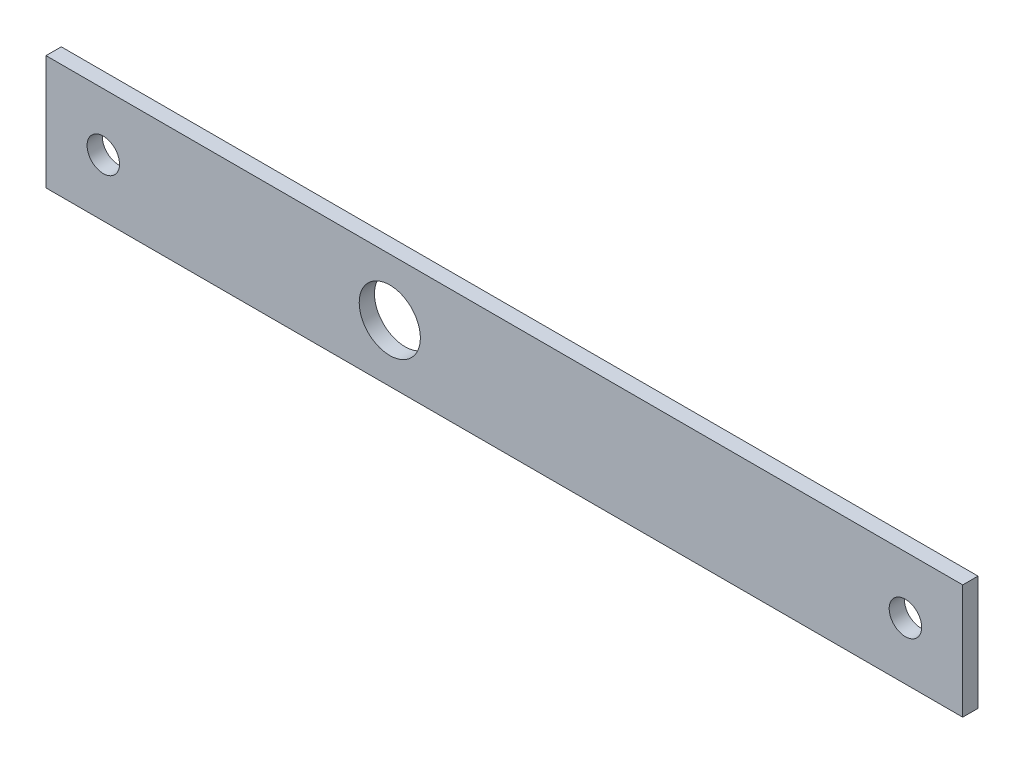
from build123d import *

# Parameters (mm, degrees)
SKETCH1_W           = 240
SKETCH1_H           = 30
BOSS_EXTRUDE1_DEPTH = 4
SKETCH2_R           = 4.25
CUT_EXTRUDE1_DEPTH  = 242.900806117
SKETCH3_R           = 8
CUT_EXTRUDE2_DEPTH  = 242.900806117


with BuildPart() as part:
    # Sketch1 → Boss-Extrude1 (new body)
    with BuildSketch(Plane.XY):
        with Locations((120, 15)):
            Rectangle(SKETCH1_W, SKETCH1_H)
    extrude(amount=BOSS_EXTRUDE1_DEPTH)

    # Sketch2 → Cut-Extrude1 (cut, through all)
    with BuildSketch(Plane.XY.offset(4)):
        with Locations((225, 15)):
            Circle(SKETCH2_R)
        with Locations((15, 15)):
            Circle(SKETCH2_R)
    extrude(amount=-CUT_EXTRUDE1_DEPTH, mode=Mode.SUBTRACT)

    # Sketch3 → Cut-Extrude2 (cut, through all)
    with BuildSketch(Plane(origin=(0, 0, 0), x_dir=(-1, 0, 0), z_dir=(0, 0, -1))):
        with Locations((-90, 15)):
            Circle(SKETCH3_R)
    extrude(amount=-CUT_EXTRUDE2_DEPTH, mode=Mode.SUBTRACT)


solid = part.part
